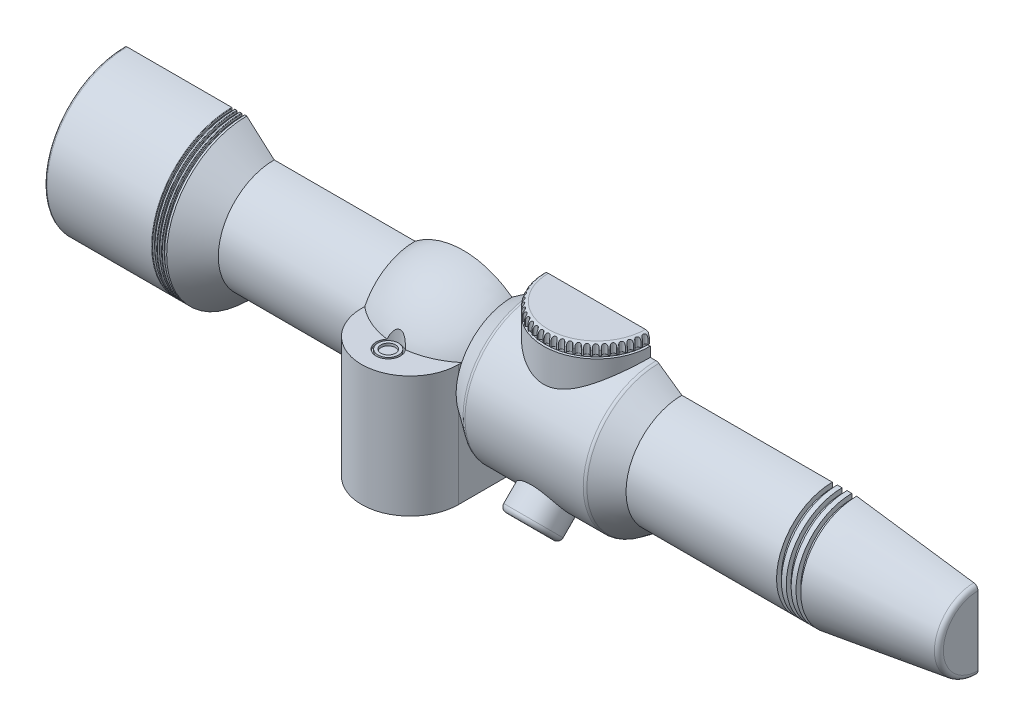
from build123d import *

# Parameters (mm, degrees)
SKETCH1_R                = 16.5
BOSS_EXTRUDE1_DEPTH      = 25.15
SKETCH2_R                = 14.125
CUT_EXTRUDE1_DEPTH       = 1
SKETCH3_R                = 13.125
CUT_EXTRUDE6_DEPTH       = 1
SKETCH14_R               = 12.125
CUT_EXTRUDE7_DEPTH       = 1
SKETCH15_R               = 11.125000000000002
CUT_EXTRUDE8_DEPTH       = 1
SKETCH16_R               = 10.125
CUT_EXTRUDE9_DEPTH       = 1
SKETCH17_R               = 9.125
CUT_EXTRUDE10_DEPTH      = 3
SKETCH21_R               = 11.500000000000002
SHAFT_DEPTH              = 120
SKETCH25_W               = 0.5
SKETCH25_H               = 0.5
FILLET1_R                = 0.1
FILLET2_R                = 0.5
SKETCH27_W               = 1
SKETCH27_H               = 1
SKETCH27_H_2             = 0.9999999999999982
BOSS_EXTRUDE2_DEPTH      = 5
BOSS_EXTRUDE2_DEPTH_BACK = 20
SKETCH29_R               = 2.750000000000008
CUT_EXTRUDE11_DEPTH      = 10
REVOLVE7_ANGLE           = 180.0000000000004
CUT_EXTRUDE12_START      = -0.5
SKETCH31_R               = 2.4999999999999956
CUT_EXTRUDE12_DEPTH      = 10.5
SKETCH32_R               = 2.125000000000003
SKETCH32_R_2             = 1.4999999999999973
BOSS_EXTRUDE3_DEPTH      = 0.5
SKETCH34_R               = 11.99999999999999
BOSS_EXTRUDE4_DEPTH      = 19.5
FILLET3_R                = 1
SKETCH36_W               = 0.5
SKETCH36_H               = 0.5
CUT_EXTRUDE13_REACH      = 183.51
SKETCH39_R               = 0.49999999999999917
CIRPATTERN1_COUNT        = 53
SKETCH40_R               = 10.999999999999993
BOSS_EXTRUDE5_DEPTH      = 19.5
SKETCH41_R               = 5.000000000000004
BOSS_EXTRUDE6_DEPTH      = 19.5
FILLET4_R                = 1
SKETCH43_W               = 0.5
SKETCH43_H               = 0.5
FILLET5_R                = 1
CUT_EXTRUDE14_REACH      = 183.403
SKETCH44_R               = 0.49999999999999917
CIRPATTERN2_COUNT        = 53
SKETCH45_W               = 199.76180513447588
SKETCH45_H               = 54.821107430784096
CUT_EXTRUDE15_DEPTH      = 179.1758682969161
SKETCH46_R               = 2.750000000000008
SKETCH46_R_2             = 2.7499999999999982
CUT_EXTRUDE16_DEPTH      = 5


with BuildPart() as part:
    # Sketch1 → Boss-Extrude1 (new body)
    with BuildSketch(Plane(origin=(0, 0, 0), x_dir=(0, 0, -1), z_dir=(1, 0, 0))):
        with Locations(Location((0, 0, 0), (0, 0, 180))):
            Circle(SKETCH1_R)
    extrude(amount=BOSS_EXTRUDE1_DEPTH)

    # Sketch2 → Cut-Extrude1 (cut)
    with BuildSketch(Plane.ZY):
        Circle(SKETCH2_R)
    extrude(amount=-CUT_EXTRUDE1_DEPTH, mode=Mode.SUBTRACT)

    # Sketch3 → Cut-Extrude6 (cut)
    with BuildSketch(Plane.ZY.offset(-1)):
        Circle(SKETCH3_R)
    extrude(amount=-CUT_EXTRUDE6_DEPTH, mode=Mode.SUBTRACT)

    # Sketch14 → Cut-Extrude7 (cut)
    with BuildSketch(Plane.ZY.offset(-2)):
        Circle(SKETCH14_R)
    extrude(amount=-CUT_EXTRUDE7_DEPTH, mode=Mode.SUBTRACT)

    # Sketch15 → Cut-Extrude8 (cut)
    with BuildSketch(Plane.ZY.offset(-3)):
        Circle(SKETCH15_R)
    extrude(amount=-CUT_EXTRUDE8_DEPTH, mode=Mode.SUBTRACT)

    # Sketch16 → Cut-Extrude9 (cut)
    with BuildSketch(Plane.ZY.offset(-4)):
        Circle(SKETCH16_R)
    extrude(amount=-CUT_EXTRUDE9_DEPTH, mode=Mode.SUBTRACT)

    # Sketch17 → Cut-Extrude10 (cut)
    with BuildSketch(Plane.ZY.offset(-5)):
        Circle(SKETCH17_R)
    extrude(amount=-CUT_EXTRUDE10_DEPTH, mode=Mode.SUBTRACT)

    # Sketch18 → Revolve1 (revolve)
    with BuildSketch(Plane(origin=(0, 0, 0), x_dir=(1, 0, 0), z_dir=(0, 1, 0))):
        with BuildLine():
            Line((6.467108158178063, 0), (8, 0))
            Line((8, 0), (8, 9.125))
            add(Edge.make_bspline(
                [(8, 9.125), (6.467108158178799, 4.562499999997817), (6.467108158178063, 0)],
                knots=[0, 0, 0, 0.49999999999976064, 0.49999999999976064, 0.49999999999976064], degree=2))
        make_face()
    revolve(axis=Axis((25.15, 0, 0), (-1, 0, 0)))

    # Sketch20 → Revolve5 (revolve)
    with BuildSketch(Plane(origin=(0, 0, 0), x_dir=(1, 0, 0), z_dir=(0, 1, 0)), mode=Mode.PRIVATE) as revolve5_sk:
        Polygon((30.8, 11.5), (25.15, 16.5), (25.15, 0), (30.8, 0), align=None)
    revolve(revolve5_sk.sketch.rotate(Axis((25.15, 0, 0), (1, 0, 0)), 180), axis=Axis((25.15, 0, 0), (1, 0, 0)))

    # Sketch21 → Shaft (add)
    with BuildSketch(Plane(origin=(30.8, 0, 0), x_dir=(0, 0, -1), z_dir=(1, 0, 0))):
        Circle(SKETCH21_R)
    extrude(amount=SHAFT_DEPTH)

    # Sketch25 → Cut-Revolve13 (revolve, cut)
    with BuildSketch(Plane(origin=(0, 0, 0), x_dir=(1, 0, 0), z_dir=(0, 1, 0)), mode=Mode.PRIVATE) as cut_revolve13_sk:
        with Locations((23.399999999999995, 16.25)):
            Rectangle(SKETCH25_W, SKETCH25_H)
        with Locations((24.399999999999995, 16.25)):
            Rectangle(SKETCH25_W, SKETCH25_H)
        with Locations((22.399999999999995, 16.25)):
            Rectangle(SKETCH25_W, SKETCH25_H)
    revolve(cut_revolve13_sk.sketch.rotate(Axis((25.15, 0, 0), (-1, 0, 0)), 180), axis=Axis((25.15, 0, 0), (-1, 0, 0)), mode=Mode.SUBTRACT)

    # Fillet1
    fillet1_edges = [part.edges().sort_by_distance(p)[0] for p in [
        (24.15, 4.04e-15, -16.5),
        (24.65, 4.04e-15, -16.5),
        (23.15, 4.04e-15, -16.5),
        (23.65, 4.04e-15, -16.5),
        (22.149999999999995, 4.04e-15, -16.5),
        (22.649999999999995, 4.04e-15, -16.5),
    ]]
    fillet(fillet1_edges, radius=FILLET1_R)

    # Fillet2
    fillet2_edges = [part.edges().sort_by_distance(p)[0] for p in [
        (0, -4.04e-15, -16.5),
    ]]
    fillet(fillet2_edges, radius=FILLET2_R)

    # Sketch26 → Revolve6 (revolve)
    with BuildSketch(Plane(origin=(0, 0, 0), x_dir=(1, 0, 0), z_dir=(0, 1, 0)), mode=Mode.PRIVATE) as revolve6_sk:
        with BuildLine():
            Line((150.79999999999998, -11.500000000000002), (150.79999999999998, 0))
            Line((150.79999999999998, 0), (175.79999999999998, 0))
            Line((175.79999999999998, 0), (175.79999999999998, -7.130247555090847))
            ThreePointArc((175.79999999999998, -7.130247555090847), (175.5545355672645, -7.7865067094900855), (174.9386478445344, -8.120589301765184))
            Line((174.9386478445344, -8.120589301765184), (150.79999999999998, -11.500000000000002))
        make_face()
    revolve(revolve6_sk.sketch.rotate(Axis((150.79999999999998, 0, 0), (-1, 0, 0)), 180), axis=Axis((150.79999999999998, 0, 0), (-1, 0, 0)))

    # Sketch27 → Cut-Revolve14 (revolve, cut)
    with BuildSketch(Plane(origin=(0, 0, 0), x_dir=(1, 0, 0), z_dir=(0, 1, 0)), mode=Mode.PRIVATE) as cut_revolve14_sk:
        with Locations((148.29999999999998, -11.000000000000016)):
            Rectangle(SKETCH27_W, SKETCH27_H)
        with Locations((150.29999999999998, -11.000000000000002)):
            Rectangle(SKETCH27_W, SKETCH27_H)
        with Locations((146.29999999999998, -11.000000000000028)):
            Rectangle(SKETCH27_W, SKETCH27_H_2)
    revolve(cut_revolve14_sk.sketch.rotate(Axis((150.79999999999998, 0, 0), (-1, 0, 0)), 180), axis=Axis((150.79999999999998, 0, 0), (-1, 0, 0)), mode=Mode.SUBTRACT)

    # Sketch28 → Boss-Extrude2 (add, two sides: drawn at the far end of the back side and taken through both)
    with BuildSketch(Plane(origin=(0, 0, 0), x_dir=(1, 0, 0), z_dir=(0, 1, 0)).offset(-BOSS_EXTRUDE2_DEPTH_BACK)):
        with BuildLine():
            Line((59.800000000000004, 11.000000000000016), (59.800000000000004, -10.999999999999984))
            ThreePointArc((59.800000000000004, -10.999999999999984), (69.8, -20.999999999999975), (79.8, -10.999999999999982))
            Line((79.8, -10.999999999999982), (79.8, 11.000000000000018))
            ThreePointArc((79.8, 11.000000000000018), (69.8, 21.000000000000014), (59.800000000000004, 11.000000000000016))
        make_face()
    extrude(amount=BOSS_EXTRUDE2_DEPTH + BOSS_EXTRUDE2_DEPTH_BACK)

    # Sketch29 → Cut-Extrude11 (cut)
    with BuildSketch(Plane.XZ.offset(20)):
        with Locations(Location((69.8, -11.000000000000016, 0), (0, 0, 270))):
            Circle(SKETCH29_R)
        with Locations(Location((69.8, 6.999999999999981, 0), (0, 0, 270))):
            Circle(SKETCH29_R)
    extrude(amount=-CUT_EXTRUDE11_DEPTH, mode=Mode.SUBTRACT)

    # Sketch30 → Revolve7 (revolve)
    with BuildSketch(Plane(origin=(0, 0, 0), x_dir=(1, 0, 0), z_dir=(0, 1, 0))):
        with BuildLine():
            Line((59.81250782228093, 11.500000000000002), (79.78749217771909, 11.500000000000002))
            ThreePointArc((79.78749217771909, 11.500000000000002), (69.80000000000001, 14.856157588603978), (59.81250782228093, 11.500000000000002))
        make_face()
    revolve(axis=Axis((150.79999999999998, 0, 0), (1, 0, 0)), revolution_arc=REVOLVE7_ANGLE)

    # Sketch31 → Cut-Extrude12 (cut)
    with BuildSketch(Plane(origin=(0, 5, 0), x_dir=(1, 0, 0), z_dir=(0, 1, 0)).offset(CUT_EXTRUDE12_START)):
        with Locations(Location((69.8, 15.50000000000001, 0), (0, 0, 319.408084377))):
            Circle(SKETCH31_R)
    cut_extrude12 = extrude(amount=CUT_EXTRUDE12_DEPTH, mode=Mode.SUBTRACT)

    # Sketch32 → Boss-Extrude3 (add)
    with BuildSketch(Plane(origin=(0, 4.500000000000001, 0), x_dir=(1, 0, 0), z_dir=(0, 1, 0))):
        with Locations(Location((69.8, 15.50000000000001, 0), (0, 0, 270))):
            Circle(SKETCH32_R)
        with Locations(Location((69.8, 15.50000000000001, 0), (0, 0, 270))):
            Circle(SKETCH32_R_2, mode=Mode.SUBTRACT)
    boss_extrude3 = extrude(amount=BOSS_EXTRUDE3_DEPTH)

    # Mirror2: Cut-Extrude12, Boss-Extrude3 across plane
    add(cut_extrude12.mirror(Plane.XY), mode=Mode.SUBTRACT)
    add(boss_extrude3.mirror(Plane.XY))

    # Sketch33 → Revolve8 (revolve)
    with BuildSketch(Plane(origin=(0, 0, 0), x_dir=(1, 0, 0), z_dir=(0, 1, 0))):
        with BuildLine():
            Line((79.78749217771909, 11.500000000000002), (84.52925206417486, 14.819231920519037))
            ThreePointArc((84.52925206417486, 14.819231920519037), (84.8020750236591, 14.953737888656791), (85.1027144085382, 15))
            Line((85.1027144085382, 15), (109.4722699469, 15))
            ThreePointArc((109.4722699469, 15), (109.77290933177909, 14.953737888656795), (110.04573229126333, 14.819231920519037))
            Line((110.04573229126333, 14.819231920519037), (114.7874921777191, 11.500000000000002))
            Line((114.7874921777191, 11.500000000000002), (79.78749217771909, 11.500000000000002))
        make_face()
    revolve(axis=Axis((150.79999999999998, 0, 0), (-1, 0, 0)))

    # Sketch34 → Boss-Extrude4 (add)
    with BuildSketch(Plane.XY):
        with Locations((97.2874921777191, 0)):
            Circle(SKETCH34_R)
    extrude(amount=-BOSS_EXTRUDE4_DEPTH)

    # Fillet3
    fillet3_edges = [part.edges().sort_by_distance(p)[0] for p in [
        (85.28749217771912, 1.47e-15, -19.5),
    ]]
    fillet(fillet3_edges, radius=FILLET3_R)

    # Sketch36 → Cut-Revolve15 (revolve, cut)
    with BuildSketch(Plane(origin=(0, 0, 0), x_dir=(1, 0, 0), z_dir=(0, 1, 0))):
        with Locations((85.53749217771912, 17.249999999999996)):
            Rectangle(SKETCH36_W, SKETCH36_H)
    revolve(axis=Axis((97.2874921777191, 0, -19.5), (0, 0, 1)), mode=Mode.SUBTRACT)

    # Sketch39 → Cut-Extrude13 (cut, up to next)
    with BuildSketch(Plane(origin=(0, 0, -19.5), x_dir=(-1, 0, 0), z_dir=(0, 0, -1)), mode=Mode.PRIVATE) as cut_extrude13_sk1:
        with Locations((-97.2874921777191, 11.999999999999996)):
            Circle(SKETCH39_R)
    cut_extrude13_tool1 = extrude(cut_extrude13_sk1.sketch, amount=-CUT_EXTRUDE13_REACH, mode=Mode.PRIVATE) & part.part
    cut_extrude13 = cut_extrude13_tool1.solids().sort_by_distance((97.287492, 12, -19.5))[0]
    add(cut_extrude13, mode=Mode.SUBTRACT)

    # CirPattern1: Cut-Extrude13 ×53 about axis
    cirpattern1_axis = Axis((97.28749217771906, -2.02e-15, 0), (0, 0, 1))
    for i in range(1, CIRPATTERN1_COUNT):
        add(cut_extrude13.rotate(cirpattern1_axis, i * 360 / CIRPATTERN1_COUNT), mode=Mode.SUBTRACT)

    # Sketch40 → Boss-Extrude5 (add)
    with BuildSketch(Plane(origin=(0, 0, 0), x_dir=(1, 0, 0), z_dir=(0, 1, 0))):
        with Locations(Location((97.2874921777191, 0, 0), (0, 0, 113.988784525))):
            Circle(SKETCH40_R)
    extrude(amount=BOSS_EXTRUDE5_DEPTH)

    # Sketch41 → Boss-Extrude6 (add)
    with BuildSketch(Plane(origin=(0, 0, 0), x_dir=(-1, 0, 0), z_dir=(0, 0.7071067811865475, -0.7071067811865477))):
        with Locations(Location((-97.2874921777191, 0, 0), (0, 0, 90))):
            Circle(SKETCH41_R)
    extrude(amount=-BOSS_EXTRUDE6_DEPTH)

    # Fillet4
    fillet4_edges = [part.edges().sort_by_distance(p)[0] for p in [
        (97.2874921777191, -17.32411613907042, 10.25304832720494),
    ]]
    fillet(fillet4_edges, radius=FILLET4_R)

    # Sketch43 → Cut-Revolve16 (revolve, cut)
    with BuildSketch(Plane.XY, mode=Mode.PRIVATE) as cut_revolve16_sk:
        with Locations((108.0374921777191, 17.25)):
            Rectangle(SKETCH43_W, SKETCH43_H)
    revolve(cut_revolve16_sk.sketch.rotate(Axis((97.2874921777191, 19.5, 0), (0, -1, 0)), 90), axis=Axis((97.2874921777191, 19.5, 0), (0, -1, 0)), mode=Mode.SUBTRACT)

    # Fillet5
    fillet5_edges = [part.edges().sort_by_distance(p)[0] for p in [
        (101.75962810458138, 19.5, 10.049875633641816),
    ]]
    fillet(fillet5_edges, radius=FILLET5_R)

    # Sketch44 → Cut-Extrude14 (cut, up to next)
    with BuildSketch(Plane(origin=(0, 19.5, 0), x_dir=(1, 0, 0), z_dir=(0, 1, 0)), mode=Mode.PRIVATE) as cut_extrude14_sk1:
        with Locations((97.28749217771912, 10.999999999999986)):
            Circle(SKETCH44_R)
    cut_extrude14_tool1 = extrude(cut_extrude14_sk1.sketch, amount=-CUT_EXTRUDE14_REACH, mode=Mode.PRIVATE) & part.part
    cut_extrude14 = cut_extrude14_tool1.solids().sort_by_distance((97.287492, 19.5, -11))[0]
    add(cut_extrude14, mode=Mode.SUBTRACT)

    # CirPattern2: Cut-Extrude14 ×53 about axis
    cirpattern2_axis = Axis((97.28749217771906, 0, -6e-17), (0, 1, 0))
    for i in range(1, CIRPATTERN2_COUNT):
        add(cut_extrude14.rotate(cirpattern2_axis, i * 360 / CIRPATTERN2_COUNT), mode=Mode.SUBTRACT)

    # Sketch45 → Cut-Extrude15 (cut, through all)
    with BuildSketch(Plane.XY):
        with Locations((88.51477663496954, 0.04185699517005759)):
            Rectangle(SKETCH45_W, SKETCH45_H)
    extrude(amount=-CUT_EXTRUDE15_DEPTH, mode=Mode.SUBTRACT)

    # Sketch46 → Cut-Extrude16 (cut)
    with BuildSketch(Plane(origin=(0, 0, 0), x_dir=(-1, 0, 0), z_dir=(0, 0, -1))):
        with Locations((-155.79999999999998, 0)):
            Circle(SKETCH46_R)
        with Locations((-16.46710815817806, 0)):
            Circle(SKETCH46_R_2)
        with Locations((-69.8, 0)):
            Circle(SKETCH46_R)
    extrude(amount=-CUT_EXTRUDE16_DEPTH, mode=Mode.SUBTRACT)


solid = part.part
